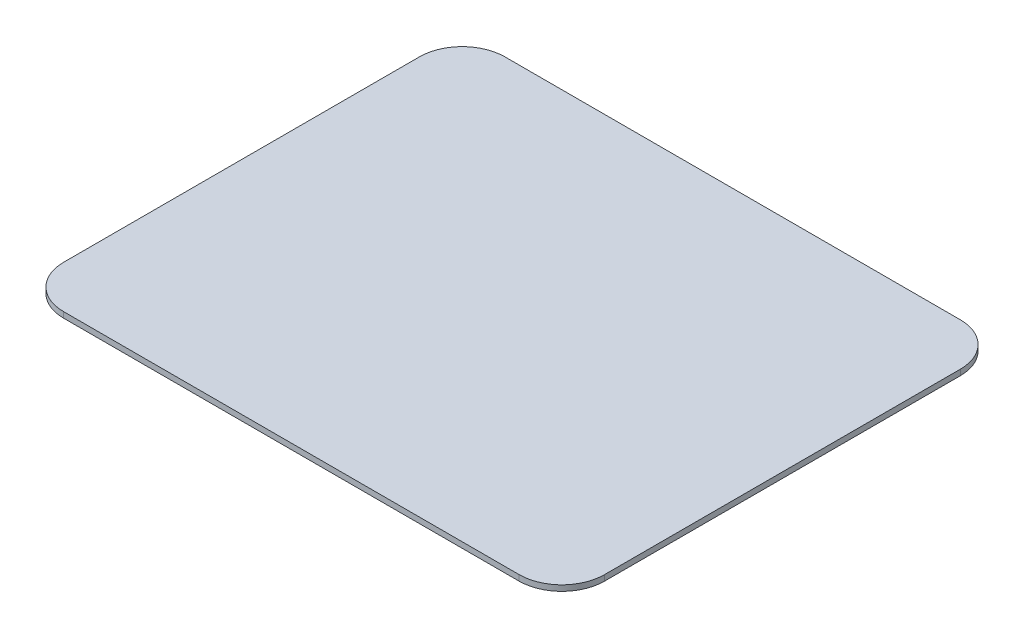
from build123d import *

# Parameters (mm, degrees)
BOSS_EXTRUDE1_DEPTH = 4


with BuildPart() as part:
    # Sketch1 → Boss-Extrude1 (new body)
    with BuildSketch(Plane(origin=(0, 0, 0), x_dir=(1, 0, 0), z_dir=(0, 1, 0))):
        with BuildLine():
            Line((160, -155), (-160, -155))
            ThreePointArc((-160, -155), (-181.213203436, -146.213203436), (-190, -125))
            Line((-190, -125), (-190, 125))
            ThreePointArc((-190, 125), (-181.213203436, 146.213203436), (-160, 155))
            Line((-160, 155), (160, 155))
            ThreePointArc((160, 155), (181.213203436, 146.213203436), (190, 125))
            Line((190, 125), (190, -125))
            ThreePointArc((190, -125), (181.213203436, -146.213203436), (160, -155))
        make_face()
    extrude(amount=BOSS_EXTRUDE1_DEPTH)


solid = part.part
